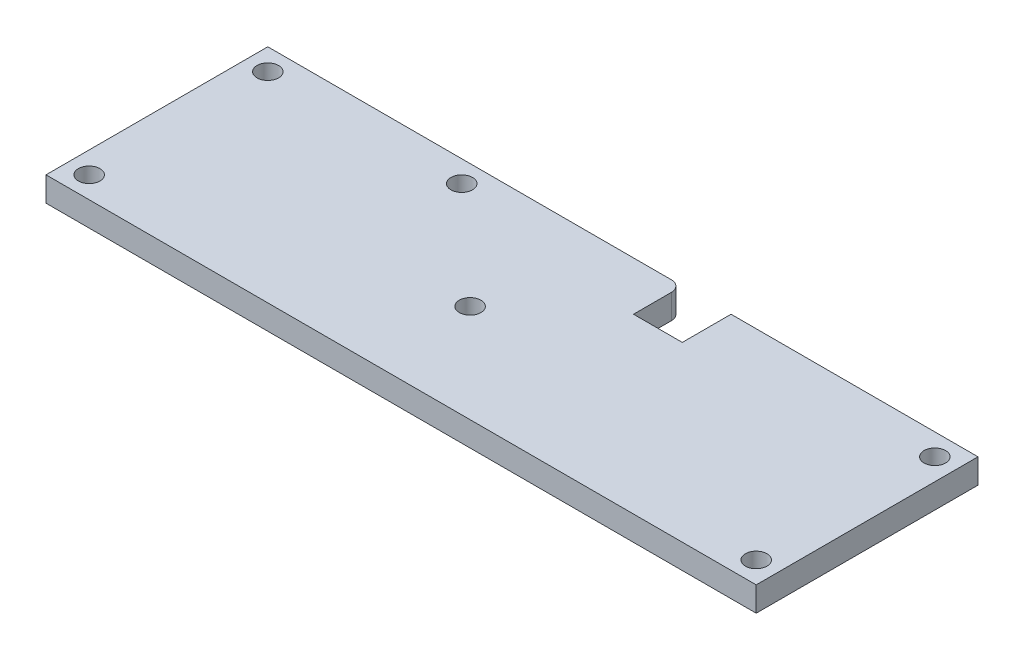
from build123d import *

# Parameters (mm, degrees)
SKETCH1_R           = 1.975
BOSS_EXTRUDE1_DEPTH = 4.5


with BuildPart() as part:
    # Sketch1 → Boss-Extrude1 (new body)
    with BuildSketch(Plane(origin=(0, 0, 0), x_dir=(1, 0, 0), z_dir=(0, 1, 0))):
        with BuildLine():
            Line((65, 20.3), (19.8, 20.3))
            Line((19.8, 20.3), (19.8, 11.37))
            Line((19.8, 11.37), (10.87, 11.37))
            Line((10.87, 11.37), (10.87, 18.3))
            ThreePointArc((10.87, 18.3), (10.284213562, 19.714213562), (8.87, 20.3))
            Line((8.87, 20.3), (-65, 20.3))
            Line((-65, 20.3), (-65, -20.3))
            Line((-65, -20.3), (65, -20.3))
            Line((65, -20.3), (65, 20.3))
        make_face()
        with Locations(Location((-61.05, 16.35, 0), (0, 0, 270))):
            Circle(SKETCH1_R, mode=Mode.SUBTRACT)
        with Locations(Location((61.05, 16.35, 0), (0, 0, 90))):
            Circle(SKETCH1_R, mode=Mode.SUBTRACT)
        with Locations(Location((61.05, -16.35, 0), (0, 0, 270))):
            Circle(SKETCH1_R, mode=Mode.SUBTRACT)
        with Locations(Location((-61.05, -16.35, 0), (0, 0, 90))):
            Circle(SKETCH1_R, mode=Mode.SUBTRACT)
        with Locations(Location((-25.55, 16.35, 0), (0, 0, 270))):
            Circle(SKETCH1_R, mode=Mode.SUBTRACT)
        with Locations(Location((-5.328324842, -2.339651524, 0), (0, 0, 270))):
            Circle(SKETCH1_R, mode=Mode.SUBTRACT)
    extrude(amount=BOSS_EXTRUDE1_DEPTH)


solid = part.part
